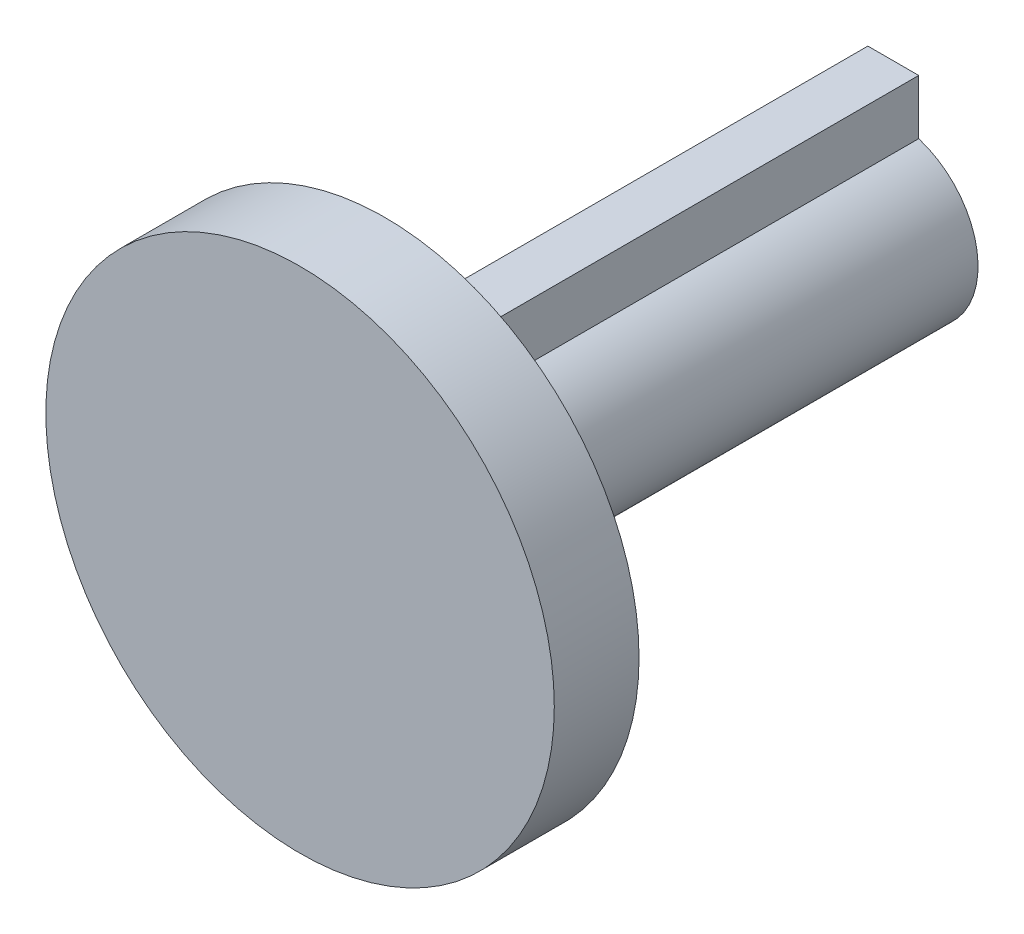
from build123d import *

# Parameters (mm, degrees)
EXTRUDE_1_DEPTH = 30
SKETCH_2_R      = 15
EXTRUDE_2_DEPTH = 5


with BuildPart() as part:
    # 草图1 → 凸台-拉伸1 (new body)
    with BuildSketch(Plane.XY):
        with BuildLine():
            Line((-1.5, 8), (-1.5, 4.769696007))
            ThreePointArc((-1.5, 4.769696007), (0, 5), (1.5, 4.769696007))
            Line((1.5, 4.769696007), (1.5, 8))
            Line((1.5, 8), (-1.5, 8))
        make_face()
        with BuildLine():
            Line((1.5, 0), (0, 0))
            Line((0, 0), (-1.5, 0))
            Line((-1.5, 0), (-1.5, 4.769696007))
            ThreePointArc((-1.5, 4.769696007), (-2.958039892, -4.031128874), (5, 0))
            ThreePointArc((5, 0), (4.031128874, 2.958039892), (1.5, 4.769696007))
            Line((1.5, 4.769696007), (1.5, 0))
        make_face()
        with BuildLine():
            Line((-1.5, 0), (0, 0))
            Line((0, 0), (1.5, 0))
            Line((1.5, 0), (1.5, 4.769696007))
            ThreePointArc((1.5, 4.769696007), (0, 5), (-1.5, 4.769696007))
            Line((-1.5, 4.769696007), (-1.5, 0))
        make_face()
    extrude(amount=EXTRUDE_1_DEPTH)

    # 草图2 → 凸台-拉伸2 (add)
    with BuildSketch(Plane.XY.offset(30)):
        Circle(SKETCH_2_R)
    extrude(amount=EXTRUDE_2_DEPTH)


solid = part.part
